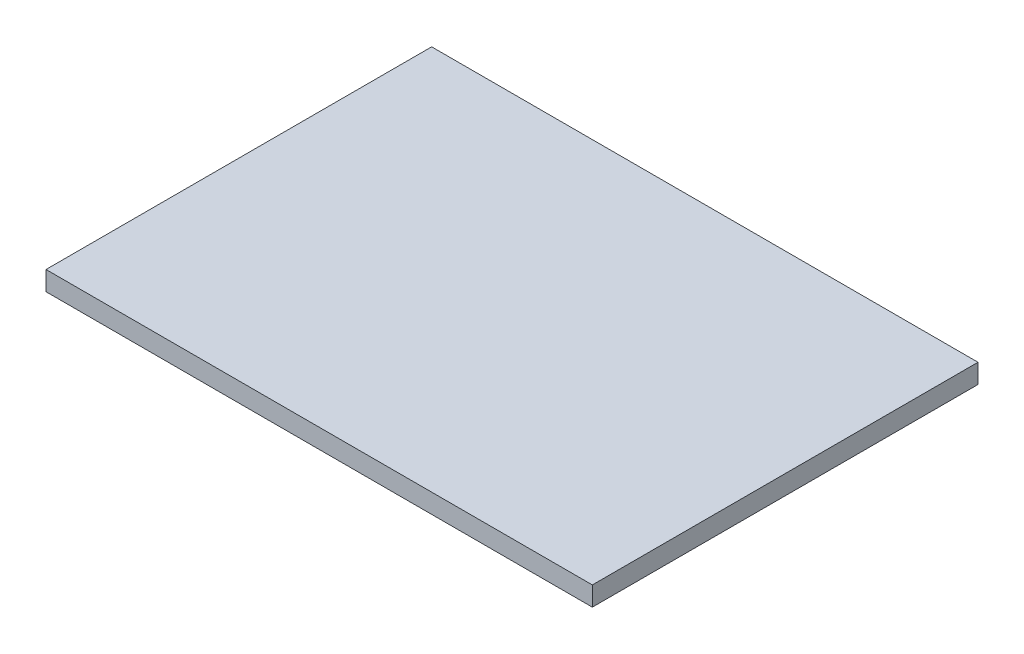
from build123d import *

# Parameters (mm, degrees)
SKETCH1_W           = 170
SKETCH1_H           = 120
BOSS_EXTRUDE1_DEPTH = 6


with BuildPart() as part:
    # Sketch1 → Boss-Extrude1 (new body)
    with BuildSketch(Plane(origin=(0, 0, 0), x_dir=(1, 0, 0), z_dir=(0, 1, 0))):
        with Locations((85, 60)):
            Rectangle(SKETCH1_W, SKETCH1_H)
    extrude(amount=BOSS_EXTRUDE1_DEPTH)


solid = part.part
